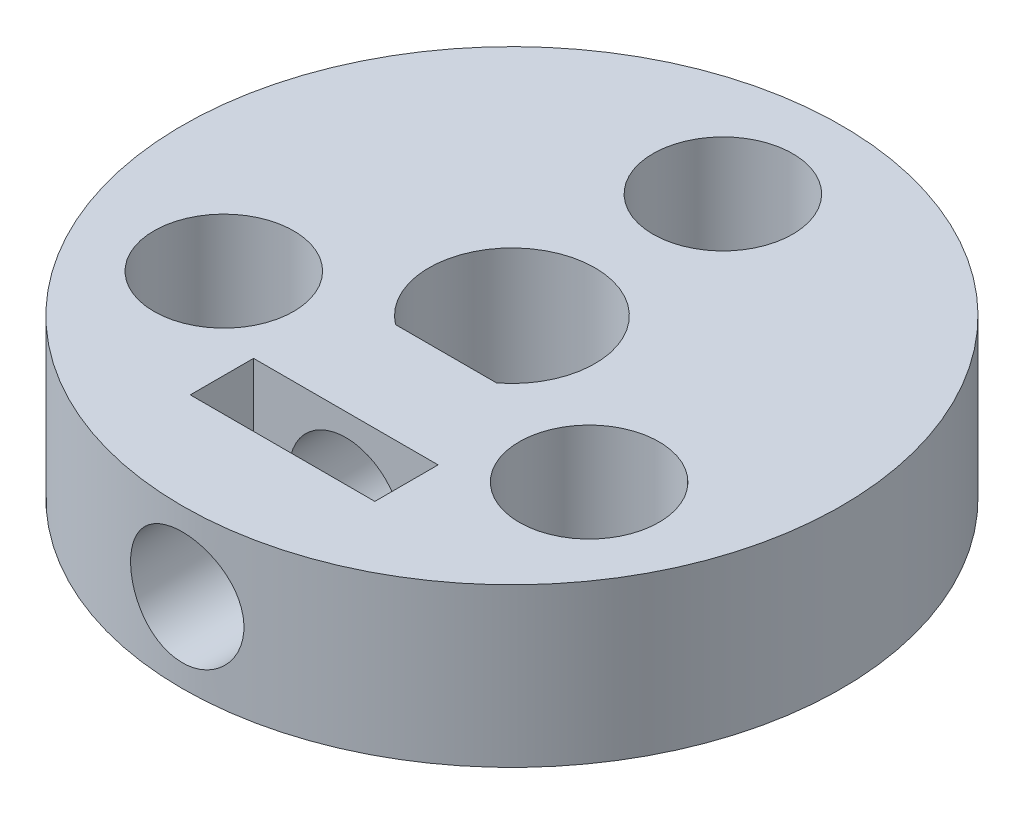
from build123d import *

# Parameters (mm, degrees)
SKETCH1_R           = 12.5
BOSS_EXTRUDE1_DEPTH = 6
CUT_EXTRUDE1_REACH  = 20.668
CUT_EXTRUDE2_REACH  = 20.668
SKETCH3_W           = 7
SKETCH3_H           = 2.4
SKETCH4_R           = 2.15
CUT_EXTRUDE3_DEPTH  = 21.426698216
SKETCH5_R           = 2.65
CUT_EXTRUDE4_DEPTH  = 19.668154869


with BuildPart() as part:
    # Sketch1 → Boss-Extrude1 (new body)
    with BuildSketch(Plane(origin=(0, 0, 0), x_dir=(1, 0, 0), z_dir=(0, 1, 0))):
        with Locations(Location((0, 0, 0), (0, 0, 270))):
            Circle(SKETCH1_R)
    extrude(amount=BOSS_EXTRUDE1_DEPTH)

    # Sketch2 → Cut-Extrude1 (cut, up to next)
    with BuildSketch(Plane(origin=(0, 6, 0), x_dir=(1, 0, 0), z_dir=(0, 1, 0)), mode=Mode.PRIVATE) as cut_extrude1_sk1:
        with BuildLine():
            ThreePointArc((0, 3.15), (-2.98307727, 1.011805317), (-1.91637679, -2.5))
            Line((-1.91637679, -2.5), (0, -2.5))
            Line((0, -2.5), (0, 3.15))
        make_face()
    cut_extrude1_tool1 = extrude(cut_extrude1_sk1.sketch, amount=-CUT_EXTRUDE1_REACH, mode=Mode.PRIVATE) & part.part
    # Sketch2 → Cut-Extrude1 (cut, up to next)
    with BuildSketch(Plane(origin=(0, 6, 0), x_dir=(1, 0, 0), z_dir=(0, 1, 0)), mode=Mode.PRIVATE) as cut_extrude1_sk2:
        with BuildLine():
            Line((0, 3.15), (0, -2.5))
            Line((0, -2.5), (1.91637679, -2.5))
            ThreePointArc((1.91637679, -2.5), (2.824808568, -1.393899766), (3.15, 0))
            ThreePointArc((3.15, 0), (2.227386361, 2.227386361), (0, 3.15))
        make_face()
    cut_extrude1_tool2 = extrude(cut_extrude1_sk2.sketch, amount=-CUT_EXTRUDE1_REACH, mode=Mode.PRIVATE) & part.part
    # Sketch2 → Cut-Extrude1 (cut, up to next)
    with BuildSketch(Plane(origin=(0, 6, 0), x_dir=(1, 0, 0), z_dir=(0, 1, 0)), mode=Mode.PRIVATE) as cut_extrude1_sk3:
        with BuildLine():
            ThreePointArc((0, 3.15), (-2.98307727, 1.011805317), (-1.91637679, -2.5))
            Line((-1.91637679, -2.5), (0, -2.5))
            Line((0, -2.5), (0, 3.15))
        make_face()
    cut_extrude1_tool3 = extrude(cut_extrude1_sk3.sketch, amount=-CUT_EXTRUDE1_REACH, mode=Mode.PRIVATE) & part.part
    # Sketch2 → Cut-Extrude1 (cut, up to next)
    with BuildSketch(Plane(origin=(0, 6, 0), x_dir=(1, 0, 0), z_dir=(0, 1, 0)), mode=Mode.PRIVATE) as cut_extrude1_sk4:
        with BuildLine():
            Line((0, 3.15), (0, -2.5))
            Line((0, -2.5), (1.91637679, -2.5))
            ThreePointArc((1.91637679, -2.5), (2.824808568, -1.393899766), (3.15, 0))
            ThreePointArc((3.15, 0), (2.227386361, 2.227386361), (0, 3.15))
        make_face()
    cut_extrude1_tool4 = extrude(cut_extrude1_sk4.sketch, amount=-CUT_EXTRUDE1_REACH, mode=Mode.PRIVATE) & part.part
    add(cut_extrude1_tool1.solids().sort_by_distance((-1.371893, 6, -0.159189))[0], mode=Mode.SUBTRACT)
    add(cut_extrude1_tool2.solids().sort_by_distance((1.371893, 6, -0.159189))[0], mode=Mode.SUBTRACT)
    add(cut_extrude1_tool3.solids().sort_by_distance((-1.371893, 6, -0.159189))[0], mode=Mode.SUBTRACT)
    add(cut_extrude1_tool4.solids().sort_by_distance((1.371893, 6, -0.159189))[0], mode=Mode.SUBTRACT)

    # Sketch3 → Cut-Extrude2 (cut, up to next)
    with BuildSketch(Plane(origin=(0, 6, 0), x_dir=(1, 0, 0), z_dir=(0, 1, 0)), mode=Mode.PRIVATE) as cut_extrude2_sk1:
        with Locations((0, -7.5)):
            Rectangle(SKETCH3_W, SKETCH3_H)
    cut_extrude2_tool1 = extrude(cut_extrude2_sk1.sketch, amount=-CUT_EXTRUDE2_REACH, mode=Mode.PRIVATE) & part.part
    add(cut_extrude2_tool1.solids().sort_by_distance((0, 6, 7.5))[0], mode=Mode.SUBTRACT)

    # Sketch4 → Cut-Extrude3 (cut, through all)
    with BuildSketch(Plane(origin=(0, 0, 2.5), x_dir=(-1, 0, 0), z_dir=(0, 0, -1))):
        with Locations((0, 3)):
            Circle(SKETCH4_R)
    extrude(amount=-CUT_EXTRUDE3_DEPTH, mode=Mode.SUBTRACT)

    # Sketch5 → Cut-Extrude4 (cut, through all)
    with BuildSketch(Plane(origin=(0, 6, 0), x_dir=(1, 0, 0), z_dir=(0, 1, 0))):
        with Locations(Location((0, 8, 0), (0, 0, 270))):
            Circle(SKETCH5_R)
        with Locations(Location((6.92820323, -4, 0), (0, 0, 270))):
            Circle(SKETCH5_R)
        with Locations(Location((-6.92820323, -4, 0), (0, 0, 270))):
            Circle(SKETCH5_R)
    extrude(amount=-CUT_EXTRUDE4_DEPTH, mode=Mode.SUBTRACT)


solid = part.part
